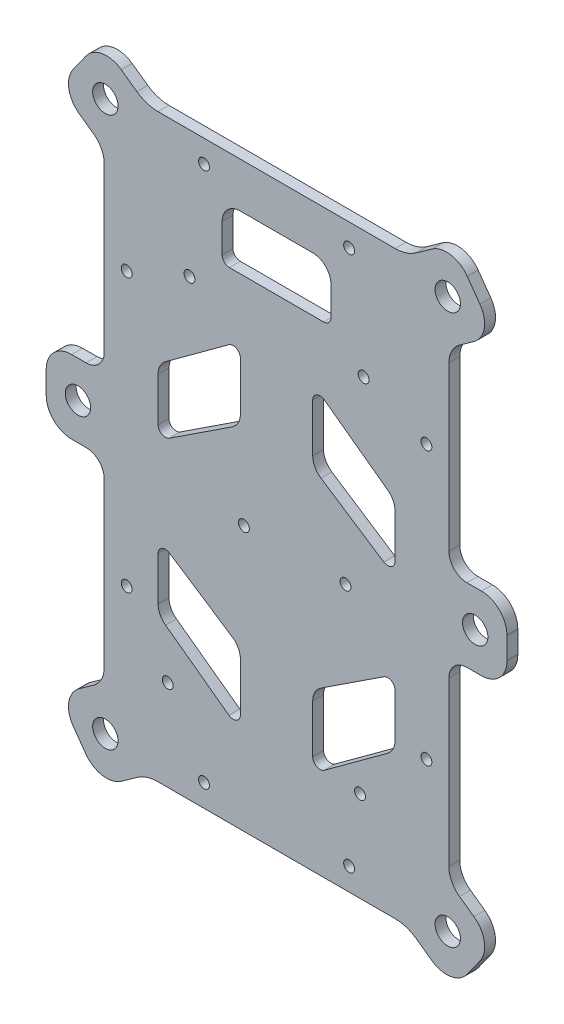
from build123d import *

# Parameters (mm, degrees)
SKETCH1_R       = 3.5
SKETCH1_R_2     = 1.5
EXTRUDE_1_DEPTH = 3


with BuildPart() as part:
    # Sketch1 → Бобышка-Вытянуть1 (new body)
    with BuildSketch(Plane.XY):
        with BuildLine():
            Line((-24.498196466, 18.686253871), (-28.812938034, 21.763271713))
            ThreePointArc((-28.812938034, 21.763271713), (-34.033313652, 22.967935089), (-38.576502294, 20.128397731))
            Line((-38.576502294, 20.128397731), (-42.0602267, 15.24335277))
            ThreePointArc((-42.0602267, 15.24335277), (-43.264890076, 10.022977152), (-40.425352718, 5.47978851))
            Line((-40.425352718, 5.47978851), (-36.440527218, 2.638047245))
            ThreePointArc((-36.440527218, 2.638047245), (-34.281914219, 0.144259766), (-33.504872357, -3.061171876))
            Line((-33.504872357, -3.061171876), (-33.504872357, -48.061171876))
            ThreePointArc((-33.504872357, -48.061171876), (-34.969338451, -51.596705782), (-38.504872357, -53.061171876))
            Line((-38.504872357, -53.061171876), (-42.504872357, -53.061171876))
            ThreePointArc((-42.504872357, -53.061171876), (-47.454619825, -55.111424407), (-49.504872357, -60.061171876))
            Line((-49.504872357, -60.061171876), (-49.500334917, -60.235639257))
            Line((-49.500334917, -60.235639257), (-49.500334917, -66.108369799))
            Line((-49.500334917, -66.108369799), (-49.504872357, -66.28283718))
            ThreePointArc((-49.504872357, -66.28283718), (-47.454619825, -71.232584649), (-42.504872357, -73.28283718))
            Line((-42.504872357, -73.28283718), (-38.504872357, -73.28283718))
            ThreePointArc((-38.504872357, -73.28283718), (-34.969338451, -74.747303275), (-33.504872357, -78.28283718))
            Line((-33.504872357, -78.28283718), (-33.504872357, -123.28283718))
            ThreePointArc((-33.504872357, -123.28283718), (-34.281914219, -126.488268823), (-36.440527218, -128.982056301))
            Line((-36.440527218, -128.982056301), (-40.425352718, -131.823797566))
            ThreePointArc((-40.425352718, -131.823797566), (-43.264890076, -136.366986209), (-42.0602267, -141.587361827))
            Line((-42.0602267, -141.587361827), (-38.576502294, -146.472406787))
            ThreePointArc((-38.576502294, -146.472406787), (-34.033313652, -149.311944145), (-28.812938034, -148.107280769))
            Line((-28.812938034, -148.107280769), (-24.498196466, -145.030262927))
            ThreePointArc((-24.498196466, -145.030262927), (-21.740151192, -143.647892601), (-18.691989124, -143.172004528))
            Line((-18.691989124, -143.172004528), (46.687073776, -143.172004528))
            ThreePointArc((46.687073776, -143.172004528), (49.735235844, -143.647892601), (52.493281118, -145.030262927))
            Line((52.493281118, -145.030262927), (56.808022686, -148.107280769))
            ThreePointArc((56.808022686, -148.107280769), (62.028398304, -149.311944145), (66.571586947, -146.472406787))
            Line((66.571586947, -146.472406787), (70.055311352, -141.587361827))
            ThreePointArc((70.055311352, -141.587361827), (71.259974728, -136.366986209), (68.42043737, -131.823797566))
            Line((68.42043737, -131.823797566), (64.43561187, -128.982056301))
            ThreePointArc((64.43561187, -128.982056301), (62.276998871, -126.488268823), (61.499957009, -123.28283718))
            Line((61.499957009, -123.28283718), (61.499957009, -78.28283718))
            ThreePointArc((61.499957009, -78.28283718), (62.964423103, -74.747303275), (66.499957009, -73.28283718))
            Line((66.499957009, -73.28283718), (70.499957009, -73.28283718))
            ThreePointArc((70.499957009, -73.28283718), (75.449704478, -71.232584649), (77.499957009, -66.28283718))
            Line((77.499957009, -66.28283718), (77.495419569, -66.108369799))
            Line((77.495419569, -66.108369799), (77.495419569, -60.235639257))
            Line((77.495419569, -60.235639257), (77.499957009, -60.061171876))
            ThreePointArc((77.499957009, -60.061171876), (75.449704478, -55.111424407), (70.499957009, -53.061171876))
            Line((70.499957009, -53.061171876), (66.499957009, -53.061171876))
            ThreePointArc((66.499957009, -53.061171876), (62.964423103, -51.596705782), (61.499957009, -48.061171876))
            Line((61.499957009, -48.061171876), (61.499957009, -3.061171876))
            ThreePointArc((61.499957009, -3.061171876), (62.276998871, 0.144259766), (64.43561187, 2.638047245))
            Line((64.43561187, 2.638047245), (68.42043737, 5.47978851))
            ThreePointArc((68.42043737, 5.47978851), (71.259974728, 10.022977152), (70.055311352, 15.24335277))
            Line((70.055311352, 15.24335277), (66.571586947, 20.128397731))
            ThreePointArc((66.571586947, 20.128397731), (62.028398304, 22.967935089), (56.808022686, 21.763271713))
            Line((56.808022686, 21.763271713), (52.493281118, 18.686253871))
            ThreePointArc((52.493281118, 18.686253871), (49.735235844, 17.303883544), (46.687073776, 16.827995472))
            Line((46.687073776, 16.827995472), (-18.691989124, 16.827995472))
            ThreePointArc((-18.691989124, 16.827995472), (-21.740151192, 17.303883544), (-24.498196466, 18.686253871))
        make_face()
        with Locations((68.745419569, -63.172004528)):
            Circle(SKETCH1_R, mode=Mode.SUBTRACT)
        with Locations((-40.750334917, -63.172004528)):
            Circle(SKETCH1_R, mode=Mode.SUBTRACT)
        with Locations((33.997542326, 10.633411798)):
            Circle(SKETCH1_R_2, mode=Mode.SUBTRACT)
        with Locations((-6.002457674, 10.633411798)):
            Circle(SKETCH1_R_2, mode=Mode.SUBTRACT)
        with Locations((-33.194340596, 12.605443826)):
            Circle(SKETCH1_R, mode=Mode.SUBTRACT)
        with Locations(Location((61.189425248, 12.605443826, 0), (0, 0, 180))):
            Circle(SKETCH1_R, mode=Mode.SUBTRACT)
        with Locations(Location((-6.002457674, -136.977420854, 0), (0, 0, 180))):
            Circle(SKETCH1_R_2, mode=Mode.SUBTRACT)
        with Locations(Location((33.997542326, -136.977420854, 0), (0, 0, 180))):
            Circle(SKETCH1_R_2, mode=Mode.SUBTRACT)
        with Locations((-27.314872357, -100.78283718)):
            Circle(SKETCH1_R_2, mode=Mode.SUBTRACT)
        with Locations((55.309957009, -100.78283718)):
            Circle(SKETCH1_R_2, mode=Mode.SUBTRACT)
        with Locations((-27.314872357, -25.561171876)):
            Circle(SKETCH1_R_2, mode=Mode.SUBTRACT)
        with Locations((55.309957009, -25.561171876)):
            Circle(SKETCH1_R_2, mode=Mode.SUBTRACT)
        with Locations((-16.002457674, -118.172004528)):
            Circle(SKETCH1_R_2, mode=Mode.SUBTRACT)
        with Locations((36.997542326, -118.172004528)):
            Circle(SKETCH1_R_2, mode=Mode.SUBTRACT)
        with Locations((61.189425248, -138.949452883)):
            Circle(SKETCH1_R, mode=Mode.SUBTRACT)
        with Locations(Location((-33.194340596, -138.949452883, 0), (0, 0, 180))):
            Circle(SKETCH1_R, mode=Mode.SUBTRACT)
        with Locations((37.997542326, -18.172004528)):
            Circle(SKETCH1_R_2, mode=Mode.SUBTRACT)
        with Locations((-10.002457674, -18.172004528)):
            Circle(SKETCH1_R_2, mode=Mode.SUBTRACT)
        with Locations((32.99754233, -70.172004528)):
            Circle(SKETCH1_R_2, mode=Mode.SUBTRACT)
        with Locations((5.00245767, -70.172004528)):
            Circle(SKETCH1_R_2, mode=Mode.SUBTRACT)
        with BuildLine():
            Line((46.654347897, -45.877785269), (46.654347897, -57.916780859))
            ThreePointArc((46.654347897, -57.916780859), (45.604469083, -59.67668703), (43.557078164, -59.588904997))
            Line((43.557078164, -59.588904997), (26.221642115, -48.21316509))
            ThreePointArc((26.221642115, -48.21316509), (24.565051018, -46.408157708), (23.964816447, -44.032854745))
            Line((23.964816447, -44.032854745), (23.964816447, -36.732206564))
            Line((23.964816447, -36.732206564), (23.964816447, -30.674839138))
            ThreePointArc((23.964816447, -30.674839138), (25.060023185, -28.891205445), (27.1461656, -29.06101939))
            Line((27.1461656, -29.06101939), (44.60772078, -41.843235899))
            ThreePointArc((44.60772078, -41.843235899), (46.113432131, -43.615802114), (46.654347897, -45.877785269))
        make_face(mode=Mode.SUBTRACT)
        with BuildLine():
            Line((26.221642115, -98.352509271), (43.557078164, -86.976769364))
            ThreePointArc((43.557078164, -86.976769364), (45.604469083, -86.888987331), (46.654347897, -88.648893502))
            Line((46.654347897, -88.648893502), (46.654347897, -100.687889092))
            ThreePointArc((46.654347897, -100.687889092), (46.113432131, -102.949872247), (44.60772078, -104.722438462))
            Line((44.60772078, -104.722438462), (27.1461656, -117.50465497))
            ThreePointArc((27.1461656, -117.50465497), (25.060023185, -117.674468916), (23.964816447, -115.890835223))
            Line((23.964816447, -115.890835223), (23.964816447, -109.833467796))
            Line((23.964816447, -109.833467796), (23.964816447, -102.532819616))
            ThreePointArc((23.964816447, -102.532819616), (24.565051018, -100.157516653), (26.221642115, -98.352509271))
        make_face(mode=Mode.SUBTRACT)
        with BuildLine():
            Line((-18.659263245, -100.687889092), (-18.659263245, -88.648893502))
            ThreePointArc((-18.659263245, -88.648893502), (-17.60938443, -86.888987331), (-15.561993512, -86.976769364))
            Line((-15.561993512, -86.976769364), (1.773442538, -98.352509271))
            ThreePointArc((1.773442538, -98.352509271), (3.430033634, -100.157516653), (4.030268205, -102.532819616))
            Line((4.030268205, -102.532819616), (4.030268205, -109.833467796))
            Line((4.030268205, -109.833467796), (4.030268205, -115.890835223))
            ThreePointArc((4.030268205, -115.890835223), (2.935061467, -117.674468916), (0.848919052, -117.50465497))
            Line((0.848919052, -117.50465497), (-16.612636128, -104.722438462))
            ThreePointArc((-16.612636128, -104.722438462), (-18.118347479, -102.949872247), (-18.659263245, -100.687889092))
        make_face(mode=Mode.SUBTRACT)
        with BuildLine():
            Line((1.773442538, -48.21316509), (-15.561993512, -59.588904997))
            ThreePointArc((-15.561993512, -59.588904997), (-17.60938443, -59.67668703), (-18.659263245, -57.916780859))
            Line((-18.659263245, -57.916780859), (-18.659263245, -45.877785269))
            ThreePointArc((-18.659263245, -45.877785269), (-18.118347479, -43.615802114), (-16.612636128, -41.843235899))
            Line((-16.612636128, -41.843235899), (0.848919052, -29.06101939))
            ThreePointArc((0.848919052, -29.06101939), (2.935061467, -28.891205445), (4.030268205, -30.674839138))
            Line((4.030268205, -30.674839138), (4.030268205, -36.732206564))
            Line((4.030268205, -36.732206564), (4.030268205, -44.032854745))
            ThreePointArc((4.030268205, -44.032854745), (3.430033634, -46.408157708), (1.773442538, -48.21316509))
        make_face(mode=Mode.SUBTRACT)
        with BuildLine():
            Line((0.997542326, -10.561171876), (26.997542326, -10.561171876))
            ThreePointArc((26.997542326, -10.561171876), (28.411755888, -9.975385438), (28.997542326, -8.561171876))
            Line((28.997542326, -8.561171876), (28.997542326, -0.561171876))
            ThreePointArc((28.997542326, -0.561171876), (27.533076232, 2.97436203), (23.997542326, 4.438828124))
            Line((23.997542326, 4.438828124), (3.997542326, 4.438828124))
            ThreePointArc((3.997542326, 4.438828124), (0.46200842, 2.97436203), (-1.002457674, -0.561171876))
            Line((-1.002457674, -0.561171876), (-1.002457674, -8.561171876))
            ThreePointArc((-1.002457674, -8.561171876), (-0.416671236, -9.975385438), (0.997542326, -10.561171876))
        make_face(mode=Mode.SUBTRACT)
    extrude(amount=-EXTRUDE_1_DEPTH)


solid = part.part
